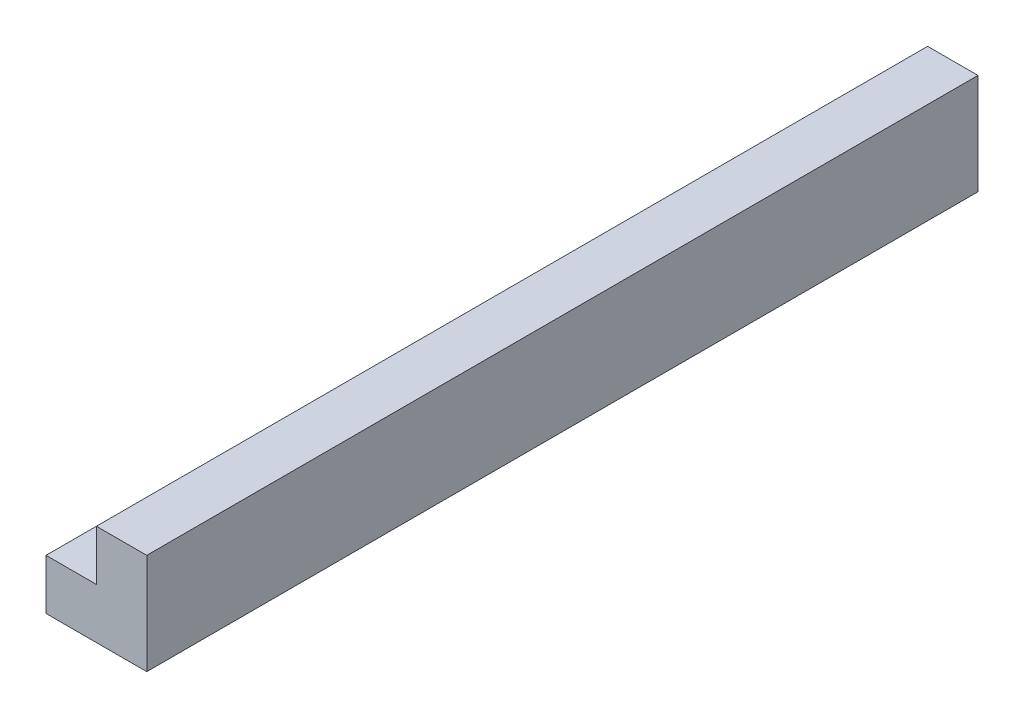
from build123d import *

# Parameters (mm, degrees)
BOSS_EXTRU_1_DEPTH = 165


with BuildPart() as part:
    # Esquisse1 → Boss.-Extru.1 (new body)
    with BuildSketch(Plane.XY):
        Polygon((0, 0), (20, 0), (20, 20), (10, 20), (10, 10), (0, 10), align=None)
    extrude(amount=BOSS_EXTRU_1_DEPTH)


solid = part.part
